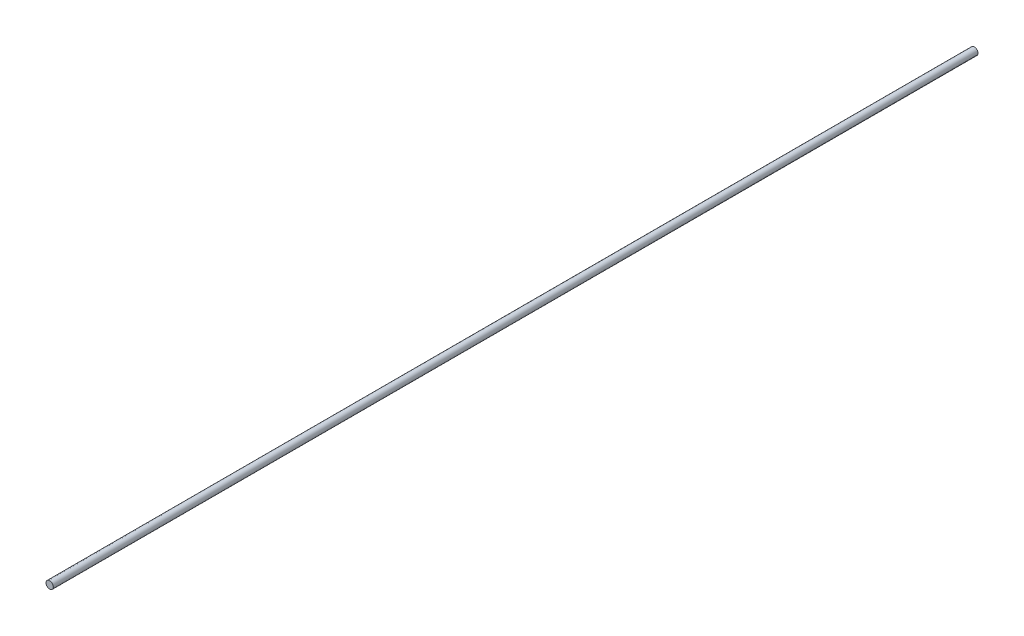
from build123d import *

# Parameters (mm, degrees)
SKETCH1_W = 190
SKETCH1_H = 0.75


with BuildPart() as part:
    # Sketch1 → Revolve1 (revolve)
    with BuildSketch(Plane(origin=(0, 0, 0), x_dir=(0, 0, -1), z_dir=(1, 0, 0)), mode=Mode.PRIVATE) as revolve1_sk:
        with Locations((95, 0.375)):
            Rectangle(SKETCH1_W, SKETCH1_H)
    revolve(revolve1_sk.sketch.rotate(Axis((0, 0, 0), (0, 0, -1)), 90), axis=Axis((0, 0, 0), (0, 0, -1)))


solid = part.part
